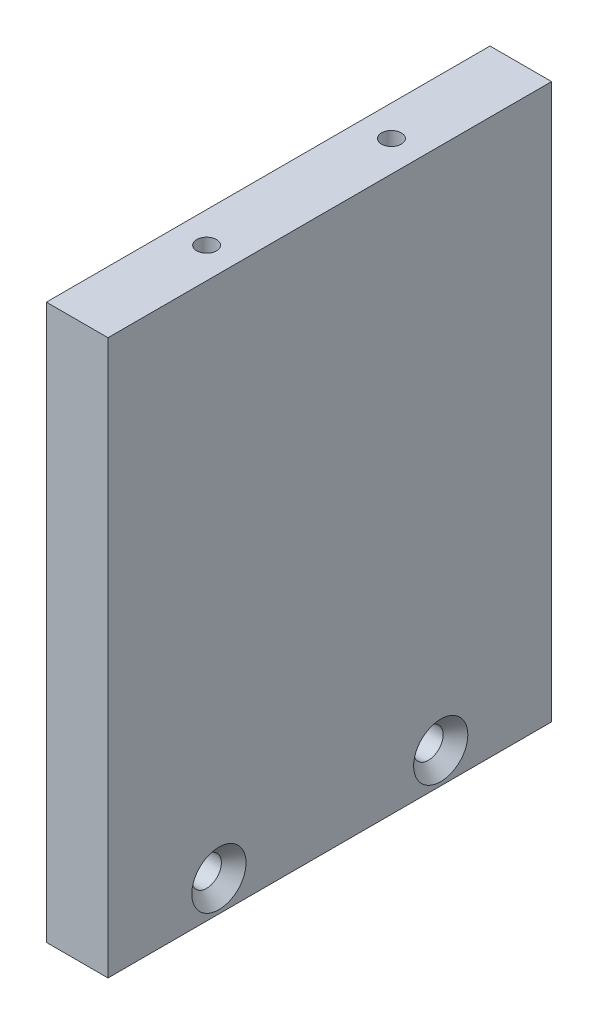
from build123d import *

# Parameters (mm, degrees)
SKETCH1_W                                           = 36
SKETCH1_H                                           = 45
BOSS_EXTRUDE1_DEPTH                                 = 5
M2_TAPPED_HOLE1_D                                   = 1.6
M2_TAPPED_HOLE1_DEPTH                               = 5
M2_TAPPED_HOLE1_TIP                                 = 0.480688495
CSK_FOR_M2_COUNTERSUNK_FLAT_HEAD_SCREW1_D           = 2.4
CSK_FOR_M2_COUNTERSUNK_FLAT_HEAD_SCREW1_CSINK_D     = 4.4
CSK_FOR_M2_COUNTERSUNK_FLAT_HEAD_SCREW1_CSINK_ANGLE = 90


with BuildPart() as part:
    # Sketch1 → Boss-Extrude1 (new body)
    with BuildSketch(Plane(origin=(0, 0, 0), x_dir=(0, 0, -1), z_dir=(1, 0, 0))):
        Rectangle(SKETCH1_W, SKETCH1_H)
    extrude(amount=BOSS_EXTRUDE1_DEPTH)

    # M2 Tapped Hole1
    with Locations(Plane(origin=(0, 22.5, 0), x_dir=(1, 0, 0), z_dir=(0, 1, 0))):
        with Locations((2.5, 7.5), (2.5, -7.5)):
            Hole(M2_TAPPED_HOLE1_D / 2, depth=M2_TAPPED_HOLE1_DEPTH)
            with Locations((0, 0, -(M2_TAPPED_HOLE1_DEPTH + M2_TAPPED_HOLE1_TIP / 2))):  # 118° drill point
                Cone(0, M2_TAPPED_HOLE1_D / 2, M2_TAPPED_HOLE1_TIP, mode=Mode.SUBTRACT)

    # CSK for M2 Countersunk Flat Head Screw1 (through all)
    with Locations(Plane(origin=(5, 0, 0), x_dir=(0, 0, -1), z_dir=(1, 0, 0))):
        with Locations((-9, -20), (9, -20)):
            CounterSinkHole(CSK_FOR_M2_COUNTERSUNK_FLAT_HEAD_SCREW1_D / 2, CSK_FOR_M2_COUNTERSUNK_FLAT_HEAD_SCREW1_CSINK_D / 2, counter_sink_angle=CSK_FOR_M2_COUNTERSUNK_FLAT_HEAD_SCREW1_CSINK_ANGLE)


solid = part.part
